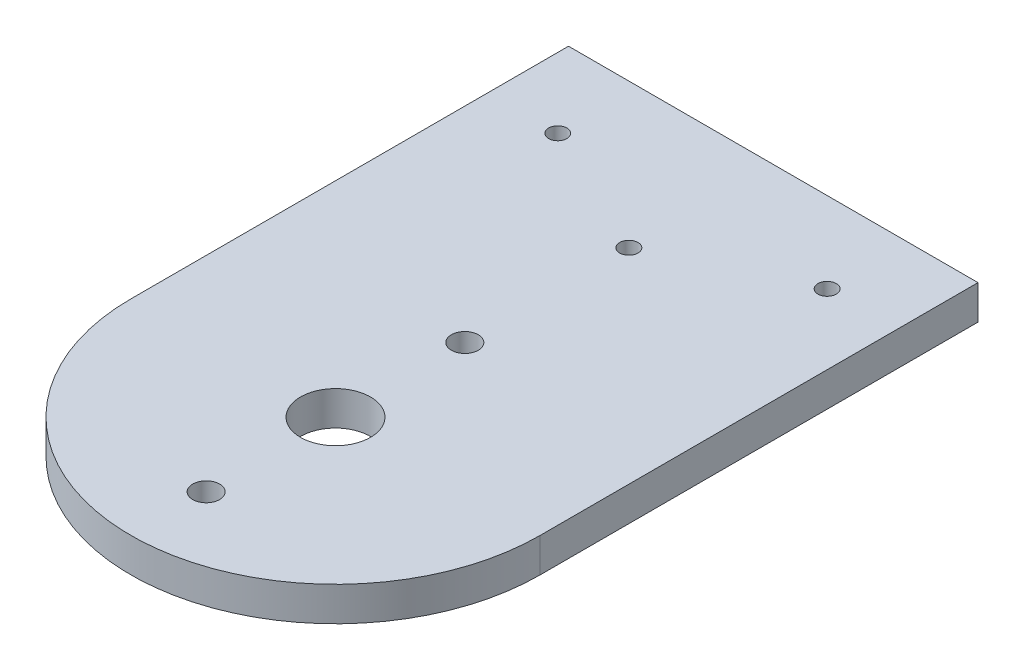
from build123d import *

# Parameters (mm, degrees)
PARED_B_CHUMACERA_J2_START          = -21.35
CROQUIS1_W                          = 76
CROQUIS1_H                          = 81.25
PARED_B_CHUMACERA_J2_DEPTH          = 6.35
PARED_B_CHUMACERA_J2_REDONDEO_START = -21.35
CROQUIS2_R                          = 38
PARED_B_CHUMACERA_J2_REDONDEO_DEPTH = 6.35
PASO_PERNO_Y_ROSCA_M6_KFL001_START  = -21.35
CROQUIS3_R                          = 6.5
CROQUIS3_R_2                        = 2.5
PASO_PERNO_Y_ROSCA_M6_KFL001_DEPTH  = 6.35
ROSCA_M3_ESCUADRAS_START            = -21.35
CROQUIS4_R                          = 1.25
ROSCA_M3_ESCUADRAS_DEPTH            = 6.35
PASADORES_D4_START                  = 90.2
CROQUIS5_R                          = 2
PASADORES_D4_DEPTH                  = 8
ROSCA_M3_BASES_CINCHO_START         = -21.35
CROQUIS6_R                          = 1.25
ROSCA_M3_BASES_CINCHO_DEPTH         = 6.35
PASO_M3_ESCUADRAS_TUERCA_START      = -21.35
CROQUIS7_R                          = 1.7
PASO_M3_ESCUADRAS_TUERCA_DEPTH      = 6.35
PASO_M3_BASE_CINCHO_TUERCA_START    = -21.35
CROQUIS8_R                          = 1.7
PASO_M3_BASE_CINCHO_TUERCA_DEPTH    = 6.35


with BuildPart() as part:
    # Croquis1 → Pared_B_chumacera_J2 (new body)
    with BuildSketch(Plane(origin=(0, 0, 0), x_dir=(1, 0, 0), z_dir=(0, 1, 0)).offset(PARED_B_CHUMACERA_J2_START)):
        with Locations((0, -130.825)):
            Rectangle(CROQUIS1_W, CROQUIS1_H)
    extrude(amount=PARED_B_CHUMACERA_J2_DEPTH)

    # Croquis2 → Pared_B_chumacera_J2_redondeo (add)
    with BuildSketch(Plane(origin=(0, 0, 0), x_dir=(1, 0, 0), z_dir=(0, 1, 0)).offset(PARED_B_CHUMACERA_J2_REDONDEO_START)):
        with Locations((0, -171.45)):
            Circle(CROQUIS2_R)
    extrude(amount=PARED_B_CHUMACERA_J2_REDONDEO_DEPTH)

    # Croquis3 → Paso_perno_y_rosca_M6_KFL001 (cut)
    with BuildSketch(Plane(origin=(0, 0, 0), x_dir=(1, 0, 0), z_dir=(0, 1, 0)).offset(PASO_PERNO_Y_ROSCA_M6_KFL001_START)):
        with Locations(Location((0, -171.45, 0), (0, 0, 270))):
            Circle(CROQUIS3_R)
        with Locations(Location((0, -195.45, 0), (0, 0, 270))):
            Circle(CROQUIS3_R_2)
        with Locations(Location((0, -147.45, 0), (0, 0, 270))):
            Circle(CROQUIS3_R_2)
    extrude(amount=PASO_PERNO_Y_ROSCA_M6_KFL001_DEPTH, mode=Mode.SUBTRACT)

    # Croquis4 → Rosca_M3_escuadras (cut)
    with BuildSketch(Plane(origin=(0, 0, 0), x_dir=(1, 0, 0), z_dir=(0, 1, 0)).offset(ROSCA_M3_ESCUADRAS_START)):
        with Locations(Location((-25, -105.2, 0), (0, 0, 270))):
            Circle(CROQUIS4_R)
        with Locations(Location((25, -105.2, 0), (0, 0, 270))):
            Circle(CROQUIS4_R)
    extrude(amount=ROSCA_M3_ESCUADRAS_DEPTH, mode=Mode.SUBTRACT)

    # Croquis5 → Pasadores_D4 (cut)
    with BuildSketch(Plane.XY.offset(PASADORES_D4_START)):
        with Locations((-30, -18.175)):
            Circle(CROQUIS5_R)
        with Locations((30, -18.175)):
            Circle(CROQUIS5_R)
    extrude(amount=PASADORES_D4_DEPTH, mode=Mode.SUBTRACT)

    # Croquis6 → Rosca_M3_bases_cincho (cut)
    with BuildSketch(Plane(origin=(0, 0, 0), x_dir=(1, 0, 0), z_dir=(0, 1, 0)).offset(ROSCA_M3_BASES_CINCHO_START)):
        with Locations(Location((0, -117, 0), (0, 0, 270))):
            Circle(CROQUIS6_R)
    extrude(amount=ROSCA_M3_BASES_CINCHO_DEPTH, mode=Mode.SUBTRACT)

    # Croquis7 → Paso_M3_escuadras_tuerca (cut)
    with BuildSketch(Plane(origin=(0, 0, 0), x_dir=(1, 0, 0), z_dir=(0, 1, 0)).offset(PASO_M3_ESCUADRAS_TUERCA_START)):
        with Locations(Location((-25, -105.2, 0), (0, 0, 270))):
            Circle(CROQUIS7_R)
        with Locations(Location((25, -105.2, 0), (0, 0, 270))):
            Circle(CROQUIS7_R)
    extrude(amount=PASO_M3_ESCUADRAS_TUERCA_DEPTH, mode=Mode.SUBTRACT)

    # Croquis8 → Paso_M3_base_cincho_tuerca (cut)
    with BuildSketch(Plane(origin=(0, 0, 0), x_dir=(1, 0, 0), z_dir=(0, 1, 0)).offset(PASO_M3_BASE_CINCHO_TUERCA_START)):
        with Locations(Location((0, -117, 0), (0, 0, 270))):
            Circle(CROQUIS8_R)
    extrude(amount=PASO_M3_BASE_CINCHO_TUERCA_DEPTH, mode=Mode.SUBTRACT)


solid = part.part
